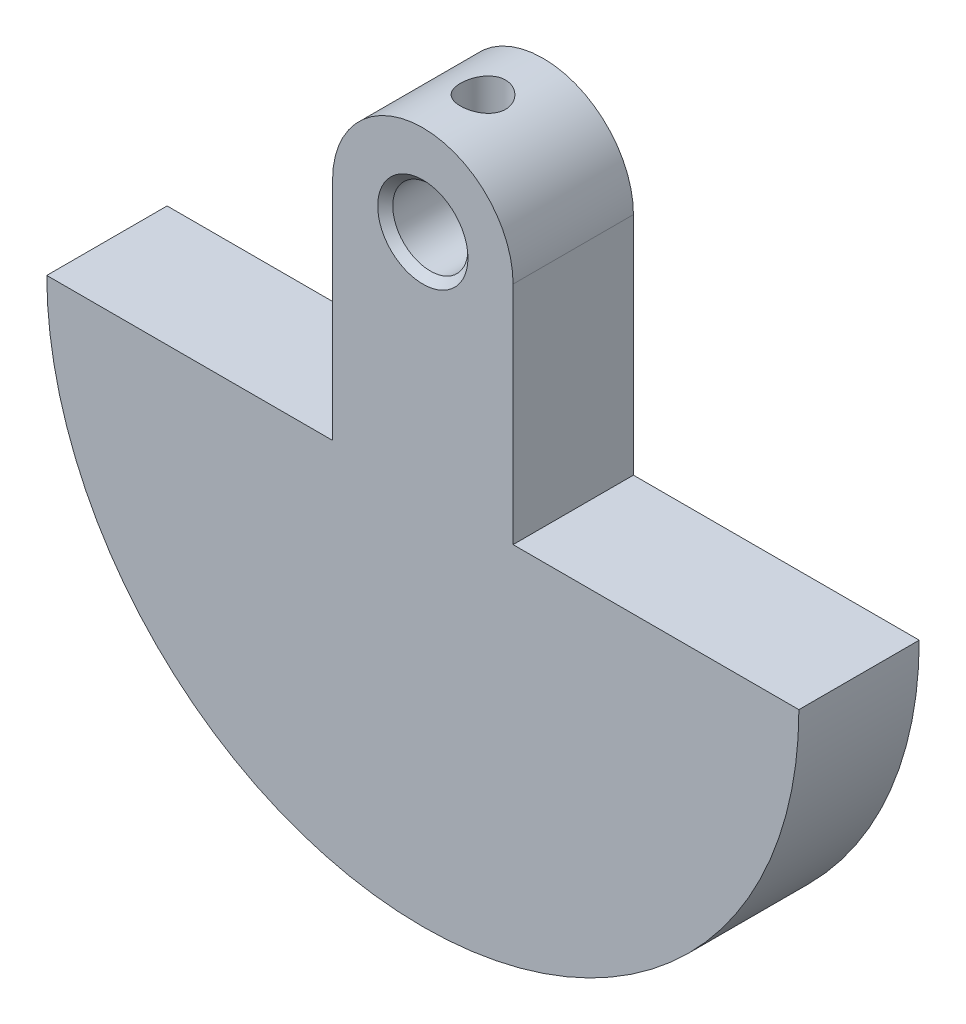
from build123d import *

# Parameters (mm, degrees)
SKETCH1_R           = 2.5
BOSS_EXTRUDE1_DEPTH = 8
CHAMFER1_SIZE       = 0.5
SKETCH2_R           = 1.5
CUT_EXTRUDE1_DEPTH  = 5


with BuildPart() as part:
    # Sketch1 → Boss-Extrude1 (new body)
    with BuildSketch(Plane.XY):
        with BuildLine():
            Line((-6, 15), (-6, 0))
            Line((-6, 0), (-25, 0))
            ThreePointArc((-25, 0), (0, -25), (25, 0))
            Line((25, 0), (6, 0))
            Line((6, 0), (6, 15))
            ThreePointArc((6, 15), (0, 21), (-6, 15))
        make_face()
        with Locations((0, 15)):
            Circle(SKETCH1_R, mode=Mode.SUBTRACT)
    extrude(amount=BOSS_EXTRUDE1_DEPTH)

    # Chamfer1
    chamfer1_edges = [part.edges().sort_by_distance(p)[0] for p in [
        (-2.5, 15, 8),
    ]]
    chamfer(chamfer1_edges, length=CHAMFER1_SIZE)

    # Sketch2 → Cut-Extrude1 (cut)
    with BuildSketch(Plane(origin=(0, 21, 0), x_dir=(1, 0, 0), z_dir=(0, 1, 0))):
        with Locations(Location((0, -4, 0), (0, 0, 270))):
            Circle(SKETCH2_R)
    extrude(amount=-CUT_EXTRUDE1_DEPTH, mode=Mode.SUBTRACT)


solid = part.part
